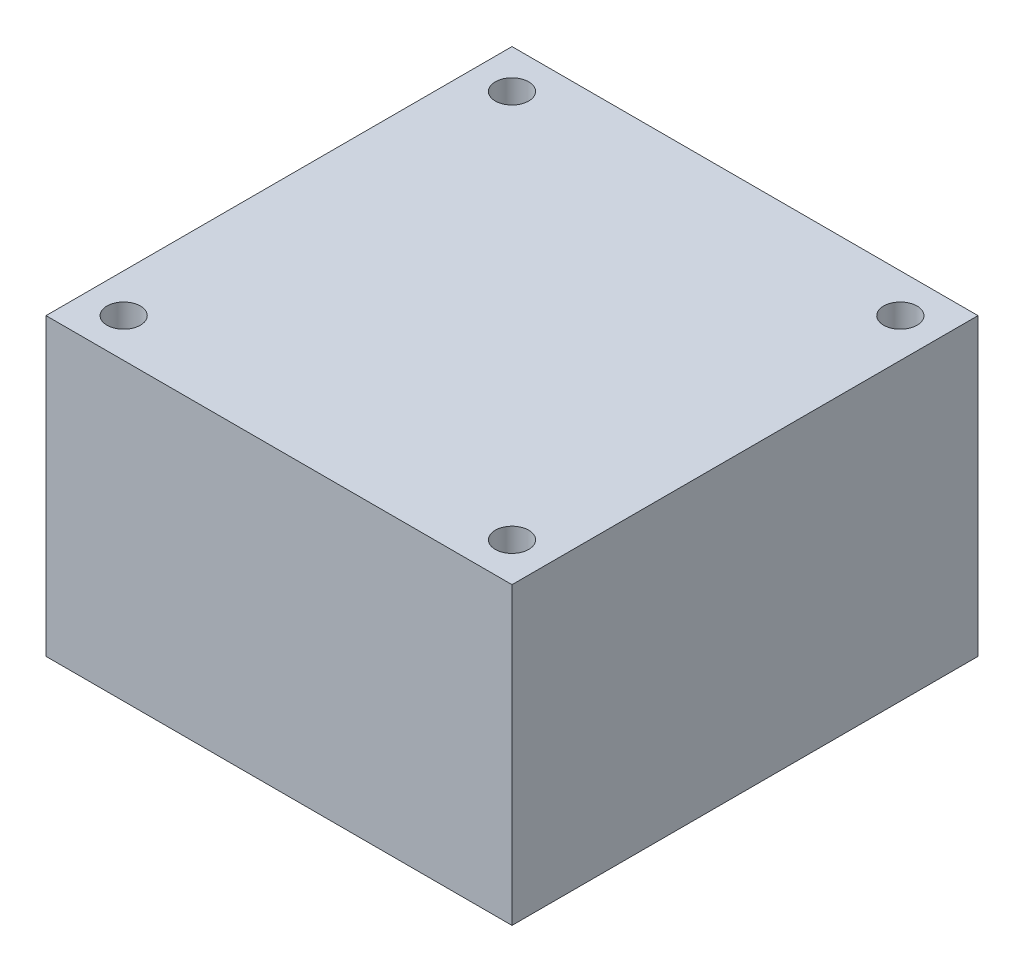
from build123d import *

# Parameters (mm, degrees)
SKETCH1_W           = 60
SKETCH1_H           = 60
BOSS_EXTRUDE1_DEPTH = 38
SKETCH2_R           = 2.15
CUT_EXTRUDE1_DEPTH  = 93.973114393


with BuildPart() as part:
    # Sketch1 → Boss-Extrude1 (new body)
    with BuildSketch(Plane(origin=(0, 0, 0), x_dir=(1, 0, 0), z_dir=(0, 1, 0))):
        with Locations((30, 30)):
            Rectangle(SKETCH1_W, SKETCH1_H)
    extrude(amount=BOSS_EXTRUDE1_DEPTH)

    # Sketch2 → Cut-Extrude1 (cut, through all)
    with BuildSketch(Plane(origin=(0, 38, 0), x_dir=(1, 0, 0), z_dir=(0, 1, 0))):
        with Locations(Location((5, 5, 0), (0, 0, 270))):
            Circle(SKETCH2_R)
        with Locations(Location((5, 55, 0), (0, 0, 270))):
            Circle(SKETCH2_R)
        with Locations(Location((55, 55, 0), (0, 0, 270))):
            Circle(SKETCH2_R)
        with Locations(Location((55, 5, 0), (0, 0, 270))):
            Circle(SKETCH2_R)
    extrude(amount=-CUT_EXTRUDE1_DEPTH, mode=Mode.SUBTRACT)


solid = part.part
